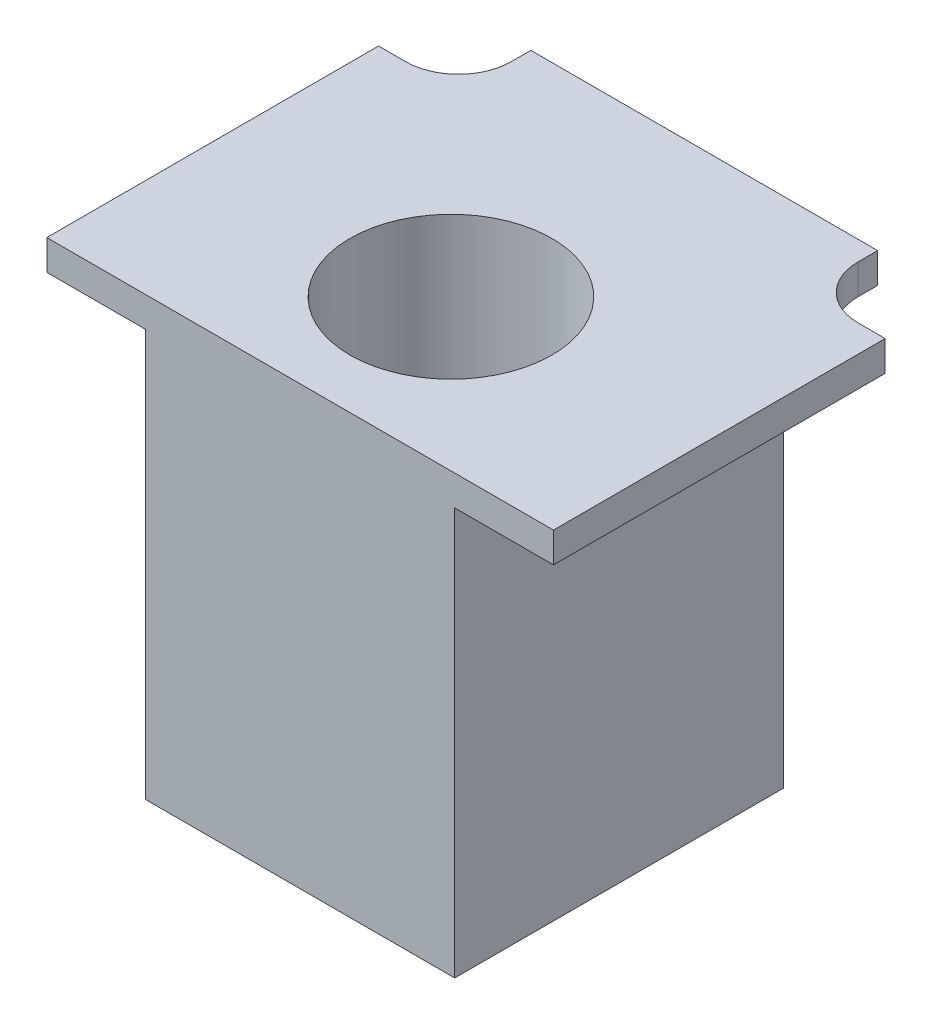
from build123d import *

# Parameters (mm, degrees)
SKETCH1_W           = 10.25
SKETCH1_H           = 10.9
BOSS_EXTRUDE1_DEPTH = 1.5
SKETCH2_W           = 6.39
SKETCH2_H           = 8.4
CUT_EXTRUDE1_DEPTH  = 8.630080275
SKETCH3_W           = 10.25
SKETCH3_H           = 10.9
SKETCH3_R           = 3.35
BOSS_EXTRUDE2_DEPTH = 13
BOSS_EXTRUDE3_DEPTH = 1


with BuildPart() as part:
    # Sketch1 → Boss-Extrude1 (new body)
    with BuildSketch(Plane(origin=(0, 0, 0), x_dir=(1, 0, 0), z_dir=(0, 1, 0))):
        Rectangle(SKETCH1_W, SKETCH1_H)
    extrude(amount=BOSS_EXTRUDE1_DEPTH)

    # Sketch2 → Cut-Extrude1 (cut, through all)
    with BuildSketch(Plane(origin=(0, 1.5, 0), x_dir=(1, 0, 0), z_dir=(0, 1, 0))):
        with Locations((0, -0.45)):
            Rectangle(SKETCH2_W, SKETCH2_H)
    extrude(amount=-CUT_EXTRUDE1_DEPTH, mode=Mode.SUBTRACT)

    # Sketch3 → Boss-Extrude2 (add)
    with BuildSketch(Plane(origin=(0, 1.5, 0), x_dir=(1, 0, 0), z_dir=(0, 1, 0))):
        Rectangle(SKETCH3_W, SKETCH3_H)
        with Locations(Location((0, -0.45, 0), (0, 0, 162.502742528))):
            Circle(SKETCH3_R, mode=Mode.SUBTRACT)
    extrude(amount=BOSS_EXTRUDE2_DEPTH)

    # Sketch5 → Boss-Extrude3 (add)
    with BuildSketch(Plane(origin=(0, 14.5, 0), x_dir=(1, 0, 0), z_dir=(0, 1, 0))):
        with BuildLine():
            Line((-5.75, 7.95), (-5.75, 7.3))
            ThreePointArc((-5.75, 7.3), (-6.262563133, 6.062563133), (-7.5, 5.55))
            Line((-7.5, 5.55), (-8.4, 5.55))
            Line((-8.4, 5.55), (-8.4, -5.45))
            Line((-8.4, -5.45), (-5.125, -5.45))
            Line((-5.125, -5.45), (-5.125, 5.45))
            Line((-5.125, 5.45), (5.125, 5.45))
            Line((5.125, 5.45), (5.125, -5.45))
            Line((5.125, -5.45), (8.4, -5.45))
            Line((8.4, -5.45), (8.4, 5.55))
            Line((8.4, 5.55), (7.5, 5.55))
            ThreePointArc((7.5, 5.55), (6.262563133, 6.062563133), (5.75, 7.3))
            Line((5.75, 7.3), (5.75, 7.95))
            Line((5.75, 7.95), (-5.75, 7.95))
        make_face()
    extrude(amount=-BOSS_EXTRUDE3_DEPTH)


solid = part.part
